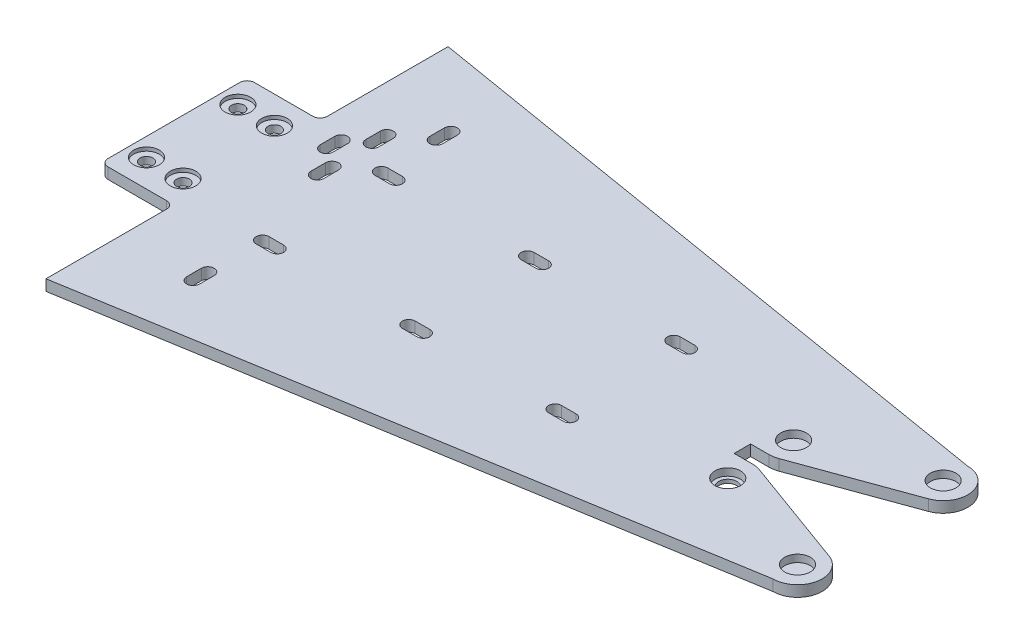
from build123d import *

# Parameters (mm, degrees)
SKETCH_1_W           = 35
SKETCH_1_H           = 55
EXTRUDE_1_DEPTH      = 1
EXTRUDE_2_DEPTH      = 3
SKETCH_3_R           = 5
CUT_EXTRUDE_1_DEPTH  = 169.569903897
SKETCH_4_R           = 4
CUT_EXTRUDE_2_DEPTH  = 2
SKETCH_5_R           = 2
CUT_EXTRUDE_3_DEPTH  = 2
EXTRUDE_START        = 7
EXTRUDE_3_DEPTH      = 7
CUT_EXTRUDE_START    = -1.5
SKETCH_9_W           = 10
SKETCH_9_H           = 26
CUT_EXTRUDE_4_DEPTH  = 168.318874833
SKETCH_10_R          = 1.5
CUT_EXTRUDE_5_DEPTH  = 194.595583627
EXTRUDE_START_2      = -3
EXTRUDE_4_DEPTH      = 3
SKETCH_12_R          = 9
SKETCH_12_R_2        = 5
EXTRUDE_5_DEPTH      = 2.5
SKETCH_13_R          = 7.5
CUT_EXTRUDE_6_DEPTH  = 4
SKETCH_14_W          = 10
SKETCH_14_H          = 26
CUT_EXTRUDE_7_DEPTH  = 2
EXTRUDE_START_3      = -1
EXTRUDE_6_DEPTH      = 2
CUT_EXTRUDE_8_DEPTH  = 170.92003224
SKETCH_17_W          = 35
SKETCH_17_H          = 55
CUT_EXTRUDE_9_DEPTH  = 1
SKETCH_19_R          = 9
EXTRUDE_8_DEPTH      = 2.5
SKETCH_20_W          = 13
SKETCH_20_H          = 1.5
EXTRUDE_9_DEPTH      = 5.5
SKETCH_21_R          = 3.5
CUT_EXTRUDE_10_DEPTH = 2
CUT_EXTRUDE_11_DEPTH = 10
SKETCH_23_R          = 1.75
CUT_EXTRUDE_12_DEPTH = 10
SKETCH_25_R          = 1.75
CUT_EXTRUDE_14_DEPTH = 170.71466453
SKETCH_29_W          = 168.729827701
SKETCH_29_H          = 37.82128197
CUT_EXTRUDE_16_DEPTH = 188.307580884
SKETCH_30_W          = 40
SKETCH_30_H          = 3
EXTRUDE_10_DEPTH     = 20
CUT_EXTRUDE_17_DEPTH = 10
SKETCH_32_R          = 3.5
CUT_EXTRUDE_18_DEPTH = 1
SKETCH_33_R          = 2.5
CUT_EXTRUDE_19_DEPTH = 1
CUT_EXTRUDE_21_DEPTH = 168.79563411
SKETCH_35_W          = 4.5
SKETCH_35_H          = 3
EXTRUDE_11_DEPTH     = 10
FILLET_1_R           = 2
FILLET_2_R           = 2


with BuildPart() as part:
    # 草图1 → 凸台-拉伸1 (new body)
    with BuildSketch(Plane(origin=(0, 0, 0), x_dir=(1, 0, 0), z_dir=(0, 1, 0))):
        Rectangle(SKETCH_1_W, SKETCH_1_H)
    extrude(amount=EXTRUDE_1_DEPTH)

    # 草图2 → 凸台-拉伸2 (add)
    with BuildSketch(Plane(origin=(0, 1, 0), x_dir=(1, 0, 0), z_dir=(0, 1, 0))):
        with BuildLine():
            Line((106.75, -2.25), (106.75, 2.25))
            Line((106.75, 2.25), (121.75, 2.25))
            ThreePointArc((121.75, 2.25), (122.922125199, 2.352547667), (124.058635967, 2.65707481))
            Line((124.058635967, 2.65707481), (154.058635967, 13.576181838))
            ThreePointArc((154.058635967, 13.576181838), (158.397452333, 21.091232227), (151.75, 26.669107028))
            Line((151.75, 26.669107028), (-31.447415548, 57.101298968))
            ThreePointArc((-31.447415548, 57.101298968), (-37.800418235, 56.264673928), (-42.609265279, 52.029632639))
            Line((-42.609265279, 52.029632639), (-60.161792173, 23.605896086))
            ThreePointArc((-60.161792173, 23.605896086), (-61.717833724, 20.073278016), (-62.25, 16.25))
            Line((-62.25, 16.25), (-62.25, -16.25))
            ThreePointArc((-62.25, -16.25), (-61.717833724, -20.073278016), (-60.161792173, -23.605896086))
            Line((-60.161792173, -23.605896086), (-42.609265279, -52.029632639))
            ThreePointArc((-42.609265279, -52.029632639), (-37.800418235, -56.264673928), (-31.447415548, -57.101298968))
            Line((-31.447415548, -57.101298968), (151.75, -26.669107028))
            ThreePointArc((151.75, -26.669107028), (158.397452333, -21.091232227), (154.058635967, -13.576181838))
            Line((154.058635967, -13.576181838), (124.058635967, -2.65707481))
            ThreePointArc((124.058635967, -2.65707481), (122.922125199, -2.352547667), (121.75, -2.25))
            Line((121.75, -2.25), (106.75, -2.25))
        make_face()
    extrude(amount=EXTRUDE_2_DEPTH)

    # 草图3 → 切除-拉伸1 (cut, through all)
    with BuildSketch(Plane(origin=(0, 4, 0), x_dir=(1, 0, 0), z_dir=(0, 1, 0))):
        with Locations(Location((-48.25, 16.25, 0), (0, 0, 270))):
            Circle(SKETCH_3_R)
        with Locations(Location((-48.25, -16.25, 0), (0, 0, 270))):
            Circle(SKETCH_3_R)
    extrude(amount=-CUT_EXTRUDE_1_DEPTH, mode=Mode.SUBTRACT)

    # 草图4 → 切除-拉伸2 (cut)
    with BuildSketch(Plane(origin=(0, 4, 0), x_dir=(1, 0, 0), z_dir=(0, 1, 0))):
        with Locations(Location((-33.25, 46.25, 0), (0, 0, 270))):
            Circle(SKETCH_4_R)
        with Locations(Location((-33.25, -46.25, 0), (0, 0, 270))):
            Circle(SKETCH_4_R)
    extrude(amount=-CUT_EXTRUDE_2_DEPTH, mode=Mode.SUBTRACT)

    # 草图5 → 切除-拉伸3 (cut)
    with BuildSketch(Plane(origin=(0, 4, 0), x_dir=(1, 0, 0), z_dir=(0, 1, 0))):
        with Locations(Location((121.75, 9, 0), (0, 0, 270))):
            Circle(SKETCH_5_R)
        with Locations(Location((121.75, -9, 0), (0, 0, 270))):
            Circle(SKETCH_5_R)
        with Locations(Location((151.75, 19.919107028, 0), (0, 0, 270))):
            Circle(SKETCH_5_R)
        with Locations(Location((151.75, -19.919107028, 0), (0, 0, 270))):
            Circle(SKETCH_5_R)
    extrude(amount=-CUT_EXTRUDE_3_DEPTH, mode=Mode.SUBTRACT)

    # 草图8 → 凸台-拉伸3 (add)
    with BuildSketch(Plane.XZ.offset(-1).offset(EXTRUDE_START)):
        with BuildLine():
            Line((-26.75, -26.25), (-39.75, -26.25))
            Line((-39.75, -26.25), (-39.75, -55.124119675))
            ThreePointArc((-39.75, -55.124119675), (-35.798281322, -56.950759894), (-31.447415548, -57.101298968))
            Line((-31.447415548, -57.101298968), (-26.75, -56.320978726))
            Line((-26.75, -56.320978726), (-26.75, -26.25))
        make_face()
    extrude_3 = extrude(amount=-EXTRUDE_3_DEPTH)

    # 镜向1: 凸台-拉伸3 across plane
    add(extrude_3.mirror(Plane.XY))

    # 草图9 → 切除-拉伸4 (cut, through all)
    with BuildSketch(Plane.XZ.offset(6).offset(CUT_EXTRUDE_START)):
        with Locations((-33.25, -40.75)):
            Rectangle(SKETCH_9_W, SKETCH_9_H)
    cut_extrude_4 = extrude(amount=-CUT_EXTRUDE_4_DEPTH, mode=Mode.SUBTRACT)

    # 镜向2: 切除-拉伸4 across plane
    add(cut_extrude_4.mirror(Plane.XY), mode=Mode.SUBTRACT)

    # 草图10 → 切除-拉伸5 (cut, through all)
    with BuildSketch(Plane.XY.offset(-53.75)):
        with Locations((-33.25, -1.5)):
            Circle(SKETCH_10_R)
    cut_extrude_5 = extrude(amount=-CUT_EXTRUDE_5_DEPTH, mode=Mode.SUBTRACT)

    # 镜向3: 切除-拉伸5 across plane
    add(cut_extrude_5.mirror(Plane.XY), mode=Mode.SUBTRACT)

    # 草图11 → 凸台-拉伸4 (add)
    with BuildSketch(Plane(origin=(0, 4, 0), x_dir=(1, 0, 0), z_dir=(0, 1, 0)).offset(EXTRUDE_START_2)):
        with BuildLine():
            Line((-62.25, 50.419925161), (-62.25, 16.25))
            ThreePointArc((-62.25, 16.25), (-61.717833724, 20.073278016), (-60.161792173, 23.605896086))
            Line((-60.161792173, 23.605896086), (-42.609265279, 52.029632639))
            ThreePointArc((-42.609265279, 52.029632639), (-37.800418235, 56.264673928), (-31.447415548, 57.101298968))
            Line((-31.447415548, 57.101298968), (-50.611286861, 60.284742405))
            ThreePointArc((-50.611286861, 60.284742405), (-58.715789535, 58.048395892), (-62.25, 50.419925161))
        make_face()
        with BuildLine():
            ThreePointArc((-60.161792173, -23.605896086), (-61.717833724, -20.073278016), (-62.25, -16.25))
            Line((-62.25, -16.25), (-62.25, -50.419925161))
            ThreePointArc((-62.25, -50.419925161), (-58.715789535, -58.048395892), (-50.611286861, -60.284742405))
            Line((-50.611286861, -60.284742405), (-31.447415548, -57.101298968))
            ThreePointArc((-31.447415548, -57.101298968), (-37.800418235, -56.264673928), (-42.609265279, -52.029632639))
            Line((-42.609265279, -52.029632639), (-60.161792173, -23.605896086))
        make_face()
    extrude(amount=EXTRUDE_4_DEPTH)

    # 草图12 → 凸台-拉伸5 (add)
    # profile 1 of 2: a face of its own
    with BuildSketch(Plane.XZ.offset(-1)):
        with Locations(Location((-48.25, 16.25, 0), (0, 0, 90))):
            Circle(SKETCH_12_R)
        with Locations(Location((-48.25, 16.25, 0), (0, 0, 90))):
            Circle(SKETCH_12_R_2, mode=Mode.SUBTRACT)
    # profile 2 of 2: a face of its own
    with BuildSketch(Plane.XZ.offset(-1)):
        with Locations(Location((-48.25, -16.25, 0), (0, 0, 90))):
            Circle(SKETCH_12_R)
        with Locations(Location((-48.25, -16.25, 0), (0, 0, 90))):
            Circle(SKETCH_12_R_2, mode=Mode.SUBTRACT)
    extrude(amount=EXTRUDE_5_DEPTH)

    # 草图13 → 切除-拉伸6 (cut)
    with BuildSketch(Plane(origin=(0, 4, 0), x_dir=(1, 0, 0), z_dir=(0, 1, 0))):
        with Locations(Location((-48.25, 16.25, 0), (0, 0, 270))):
            Circle(SKETCH_13_R)
        with Locations(Location((-48.25, -16.25, 0), (0, 0, 270))):
            Circle(SKETCH_13_R)
    extrude(amount=-CUT_EXTRUDE_6_DEPTH, mode=Mode.SUBTRACT)

    # 草图14 → 切除-拉伸7 (cut)
    with BuildSketch(Plane(origin=(0, 4, 0), x_dir=(1, 0, 0), z_dir=(0, 1, 0))):
        with Locations((-33.25, 40.75)):
            Rectangle(SKETCH_14_W, SKETCH_14_H)
        Polygon((-20.75, 55.324277157), (-45.75, 59.477200364), (-45.75, 27.75), (-38.25, 27.75), (-38.25, 53.75), (-28.25, 53.75), (-28.25, 27.75), (-20.75, 27.75), align=None)
    cut_extrude_7 = extrude(amount=-CUT_EXTRUDE_7_DEPTH, mode=Mode.SUBTRACT)

    # 草图15 → 凸台-拉伸6 (add)
    with BuildSketch(Plane(origin=(0, 2, 0), x_dir=(1, 0, 0), z_dir=(0, 1, 0)).offset(EXTRUDE_START_3)):
        Polygon((-18.75, 54.9920433), (-47.75, 59.80943422), (-47.75, 25.75), (-30.25, 25.75), (-18.75, 25.75), align=None)
    extrude_6 = extrude(amount=-EXTRUDE_6_DEPTH)

    # 草图16 → 切除-拉伸8 (cut, through all)
    with BuildSketch(Plane.XZ.offset(6)):
        with BuildLine():
            Line((-31.447415548, -57.101298968), (-26.75, -56.320978726))
            Line((-26.75, -56.320978726), (-26.75, -26.25))
            Line((-26.75, -26.25), (-39.75, -26.25))
            Line((-39.75, -26.25), (-39.75, -55.124119675))
            ThreePointArc((-39.75, -55.124119675), (-35.798281322, -56.950759894), (-31.447415548, -57.101298968))
        make_face()
        with BuildLine():
            Line((-39.75, -65.953183835), (-26.75, -64.748478677))
            Line((-26.75, -64.748478677), (-26.75, -56.320978726))
            Line((-26.75, -56.320978726), (-31.447415548, -57.101298968))
            ThreePointArc((-31.447415548, -57.101298968), (-35.798281322, -56.950759894), (-39.75, -55.124119675))
            Line((-39.75, -55.124119675), (-39.75, -65.953183835))
        make_face()
    cut_extrude_8 = extrude(amount=-CUT_EXTRUDE_8_DEPTH, mode=Mode.SUBTRACT)

    # 镜向4: 切除-拉伸4, 切除-拉伸7, 凸台-拉伸6, 切除-拉伸8 across plane
    add(cut_extrude_4.mirror(Plane.XY), mode=Mode.SUBTRACT)
    add(cut_extrude_7.mirror(Plane.XY), mode=Mode.SUBTRACT)
    add(extrude_6.mirror(Plane.XY))
    add(cut_extrude_8.mirror(Plane.XY), mode=Mode.SUBTRACT)

    # 草图17 → 切除-拉伸9 (cut)
    with BuildSketch(Plane.XZ):
        Rectangle(SKETCH_17_W, SKETCH_17_H)
    extrude(amount=-CUT_EXTRUDE_9_DEPTH, mode=Mode.SUBTRACT)

    # 草图19 → 凸台-拉伸8 (add)
    # profile 1 of 3: a face of its own
    with BuildSketch(Plane.XZ.offset(-1)):
        with BuildLine():
            Line((-50.611286861, -60.284742405), (-47.75, -59.80943422))
            Line((-47.75, -59.80943422), (-47.75, -25.75))
            Line((-47.75, -25.75), (-18.75, -25.75))
            Line((-18.75, -25.75), (-18.75, 25.75))
            Line((-18.75, 25.75), (-47.75, 25.75))
            Line((-47.75, 25.75), (-47.75, 59.80943422))
            Line((-47.75, 59.80943422), (-50.611286861, 60.284742405))
            ThreePointArc((-50.611286861, 60.284742405), (-58.715789535, 58.048395892), (-62.25, 50.419925161))
            Line((-62.25, 50.419925161), (-62.25, -50.419925161))
            ThreePointArc((-62.25, -50.419925161), (-58.715789535, -58.048395892), (-50.611286861, -60.284742405))
        make_face()
        with Locations((-48.25, -16.25)):
            Circle(SKETCH_19_R, mode=Mode.SUBTRACT)
        with Locations((-48.25, 16.25)):
            Circle(SKETCH_19_R, mode=Mode.SUBTRACT)
    # profile 2 of 3: a face of its own
    with BuildSketch(Plane.XZ.offset(-1)):
        Polygon((-26.75, 56.320978726), (-26.75, 26.25), (-39.75, 26.25), (-39.75, 58.480498794), (-47.75, 59.80943422), (-47.75, 25.75), (-18.75, 25.75), (-18.75, 54.9920433), align=None)
    # profile 3 of 3: a face of its own
    with BuildSketch(Plane.XZ.offset(-1)):
        Polygon((-26.75, -26.25), (-26.75, -56.320978726), (-18.75, -54.9920433), (-18.75, -25.75), (-47.75, -25.75), (-47.75, -59.80943422), (-39.75, -58.480498794), (-39.75, -26.25), align=None)
    extrude(amount=EXTRUDE_8_DEPTH)

    # 草图20 → 凸台-拉伸9 (add)
    with BuildSketch(Plane(origin=(0, 4, 0), x_dir=(1, 0, 0), z_dir=(0, 1, 0))):
        with Locations((-33.25, 27)):
            Rectangle(SKETCH_20_W, SKETCH_20_H)
        with Locations((-33.25, -27)):
            Rectangle(SKETCH_20_W, SKETCH_20_H)
    extrude(amount=-EXTRUDE_9_DEPTH)

    # 草图21 → 切除-拉伸10 (cut)
    with BuildSketch(Plane(origin=(0, 4, 0), x_dir=(1, 0, 0), z_dir=(0, 1, 0))):
        with Locations(Location((121.75, 9, 0), (0, 0, 270))):
            Circle(SKETCH_21_R)
        with Locations(Location((121.75, -9, 0), (0, 0, 270))):
            Circle(SKETCH_21_R)
        with Locations(Location((151.75, -19.919107028, 0), (0, 0, 270))):
            Circle(SKETCH_21_R)
        with Locations(Location((151.75, 19.919107028, 0), (0, 0, 270))):
            Circle(SKETCH_21_R)
    extrude(amount=-CUT_EXTRUDE_10_DEPTH, mode=Mode.SUBTRACT)

    # 草图22 → 切除-拉伸11 (cut)
    with BuildSketch(Plane(origin=(0, 4, 0), x_dir=(1, 0, 0), z_dir=(0, 1, 0))):
        with BuildLine():
            ThreePointArc((5.75, -14.5), (7.5, -16.25), (5.75, -18))
            Line((5.75, -18), (1.75, -18))
            ThreePointArc((1.75, -18), (0, -16.25), (1.75, -14.5))
            Line((1.75, -14.5), (5.75, -14.5))
        make_face()
        with BuildLine():
            ThreePointArc((85.75, -14.5), (87.5, -16.25), (85.75, -18))
            Line((85.75, -18), (81.75, -18))
            ThreePointArc((81.75, -18), (80, -16.25), (81.75, -14.5))
            Line((81.75, -14.5), (85.75, -14.5))
        make_face()
        with BuildLine():
            Line((3.5, 31.25), (3.5, 35.25))
            ThreePointArc((3.5, 35.25), (1.75, 37), (0, 35.25))
            Line((0, 35.25), (0, 31.25))
            ThreePointArc((0, 31.25), (1.75, 29.5), (3.5, 31.25))
        make_face()
        with BuildLine():
            Line((7.5, 16.25), (0, 16.25))
            ThreePointArc((0, 16.25), (0.512563133, 15.012563133), (1.75, 14.5))
            Line((1.75, 14.5), (5.75, 14.5))
            ThreePointArc((5.75, 14.5), (6.987436867, 15.012563133), (7.5, 16.25))
        make_face()
        with BuildLine():
            Line((81.75, 14.5), (85.75, 14.5))
            ThreePointArc((85.75, 14.5), (87.5, 16.25), (85.75, 18))
            Line((85.75, 18), (81.75, 18))
            ThreePointArc((81.75, 18), (80, 16.25), (81.75, 14.5))
        make_face()
        with BuildLine():
            ThreePointArc((1.75, 18), (0.512563133, 17.487436867), (0, 16.25))
            Line((0, 16.25), (7.5, 16.25))
            ThreePointArc((7.5, 16.25), (6.987436867, 17.487436867), (5.75, 18))
            Line((5.75, 18), (1.75, 18))
        make_face()
        with BuildLine():
            Line((3.5, -31.25), (3.5, -35.25))
            ThreePointArc((3.5, -35.25), (1.75, -37), (0, -35.25))
            Line((0, -35.25), (0, -31.25))
            ThreePointArc((0, -31.25), (1.75, -29.5), (3.5, -31.25))
        make_face()
        with BuildLine():
            Line((41.75, -18), (45.75, -18))
            ThreePointArc((45.75, -18), (47.5, -16.25), (45.75, -14.5))
            Line((45.75, -14.5), (41.75, -14.5))
            ThreePointArc((41.75, -14.5), (40, -16.25), (41.75, -18))
        make_face()
        with BuildLine():
            Line((41.75, 14.5), (45.75, 14.5))
            ThreePointArc((45.75, 14.5), (47.5, 16.25), (45.75, 18))
            Line((45.75, 18), (41.75, 18))
            ThreePointArc((41.75, 18), (40, 16.25), (41.75, 14.5))
        make_face()
    extrude(amount=-CUT_EXTRUDE_11_DEPTH, mode=Mode.SUBTRACT)

    # 草图23 → 切除-拉伸12 (cut)
    with BuildSketch(Plane(origin=(0, 4, 0), x_dir=(1, 0, 0), z_dir=(0, 1, 0))):
        with Locations(Location((-42.75, 42.75, 0), (0, 0, 270))):
            Circle(SKETCH_23_R)
        with Locations(Location((-42.75, 32.75, 0), (0, 0, 270))):
            Circle(SKETCH_23_R)
        with Locations(Location((-23.75, 32.75, 0), (0, 0, 270))):
            Circle(SKETCH_23_R)
        with Locations(Location((-23.75, 42.75, 0), (0, 0, 270))):
            Circle(SKETCH_23_R)
    cut_extrude_12 = extrude(amount=-CUT_EXTRUDE_12_DEPTH, mode=Mode.SUBTRACT)

    # 镜向5: 切除-拉伸12 across plane
    add(cut_extrude_12.mirror(Plane.XY), mode=Mode.SUBTRACT)

    # 草图25 → 切除-拉伸14 (cut, through all)
    with BuildSketch(Plane(origin=(0, 4, 0), x_dir=(1, 0, 0), z_dir=(0, 1, 0))):
        with Locations(Location((-52.25, -50.419925161, 0), (0, 0, 270))):
            Circle(SKETCH_25_R)
        with Locations(Location((-52.25, 50.419925161, 0), (0, 0, 270))):
            Circle(SKETCH_25_R)
    extrude(amount=-CUT_EXTRUDE_14_DEPTH, mode=Mode.SUBTRACT)

    # 草图29 → 切除-拉伸16 (cut, through all)
    with BuildSketch(Plane(origin=(-18.75, 0, 0), x_dir=(0, 0, -1), z_dir=(1, 0, 0))):
        with Locations((12.973579281, -2.962650989)):
            Rectangle(SKETCH_29_W, SKETCH_29_H)
    extrude(amount=-CUT_EXTRUDE_16_DEPTH, mode=Mode.SUBTRACT)

    # 草图30 → 凸台-拉伸10 (add)
    with BuildSketch(Plane.ZY.offset(18.75)):
        with Locations((0, 2.5)):
            Rectangle(SKETCH_30_W, SKETCH_30_H)
    extrude(amount=EXTRUDE_10_DEPTH)

    # 草图31 → 切除-拉伸17 (cut)
    with BuildSketch(Plane(origin=(0, 4, 0), x_dir=(1, 0, 0), z_dir=(0, 1, 0))):
        with BuildLine():
            ThreePointArc((-25.5, 12.5), (-24.987436867, 11.262563133), (-23.75, 10.75))
            Line((-23.75, 10.75), (-23.75, 12.5))
            Line((-23.75, 12.5), (-25.5, 12.5))
        make_face()
        with BuildLine():
            Line((-23.75, 12.5), (-23.75, 10.75))
            ThreePointArc((-23.75, 10.75), (-22.512563133, 11.262563133), (-22, 12.5))
            ThreePointArc((-22, 12.5), (-23.75, 14.25), (-25.5, 12.5))
            Line((-25.5, 12.5), (-23.75, 12.5))
        make_face()
        with BuildLine():
            ThreePointArc((-32, 12.5), (-34.987436867, 13.737436867), (-33.75, 10.75))
            Line((-33.75, 10.75), (-33.75, 12.5))
            Line((-33.75, 12.5), (-32, 12.5))
        make_face()
        with BuildLine():
            Line((-33.75, 12.5), (-33.75, 10.75))
            ThreePointArc((-33.75, 10.75), (-32.512563133, 11.262563133), (-32, 12.5))
            Line((-32, 12.5), (-33.75, 12.5))
        make_face()
        with BuildLine():
            ThreePointArc((-22, -12.5), (-22.512563133, -11.262563133), (-23.75, -10.75))
            Line((-23.75, -10.75), (-23.75, -12.5))
            Line((-23.75, -12.5), (-25.5, -12.5))
            ThreePointArc((-25.5, -12.5), (-23.75, -14.25), (-22, -12.5))
        make_face()
        with BuildLine():
            Line((-23.75, -12.5), (-23.75, -10.75))
            ThreePointArc((-23.75, -10.75), (-24.987436867, -11.262563133), (-25.5, -12.5))
            Line((-25.5, -12.5), (-23.75, -12.5))
        make_face()
        with BuildLine():
            ThreePointArc((-32, -12.5), (-32.512563133, -11.262563133), (-33.75, -10.75))
            Line((-33.75, -10.75), (-33.75, -12.5))
            Line((-33.75, -12.5), (-32, -12.5))
        make_face()
        with BuildLine():
            Line((-33.75, -12.5), (-33.75, -10.75))
            ThreePointArc((-33.75, -10.75), (-34.987436867, -13.737436867), (-32, -12.5))
            Line((-32, -12.5), (-33.75, -12.5))
        make_face()
    extrude(amount=-CUT_EXTRUDE_17_DEPTH, mode=Mode.SUBTRACT)

    # 草图32 → 切除-拉伸18 (cut)
    with BuildSketch(Plane(origin=(0, 4, 0), x_dir=(1, 0, 0), z_dir=(0, 1, 0))):
        with Locations(Location((-23.75, 12.5, 0), (0, 0, 270))):
            Circle(SKETCH_32_R)
        with Locations(Location((-33.75, 12.5, 0), (0, 0, 270))):
            Circle(SKETCH_32_R)
        with Locations(Location((-33.75, -12.5, 0), (0, 0, 270))):
            Circle(SKETCH_32_R)
        with Locations(Location((-23.75, -12.5, 0), (0, 0, 270))):
            Circle(SKETCH_32_R)
    extrude(amount=-CUT_EXTRUDE_18_DEPTH, mode=Mode.SUBTRACT)

    # 草图33 → 切除-拉伸19 (cut)
    with BuildSketch(Plane(origin=(0, 2, 0), x_dir=(1, 0, 0), z_dir=(0, 1, 0))):
        with Locations(Location((121.75, -9, 0), (0, 0, 270))):
            Circle(SKETCH_33_R)
    extrude(amount=-CUT_EXTRUDE_19_DEPTH, mode=Mode.SUBTRACT)

    # 草图34 → 切除-拉伸21 (cut, through all)
    with BuildSketch(Plane(origin=(0, 4, 0), x_dir=(1, 0, 0), z_dir=(0, 1, 0))):
        with BuildLine():
            Line((-13, 14.25), (-13, 18.25))
            ThreePointArc((-13, 18.25), (-11.25, 20), (-9.5, 18.25))
            Line((-9.5, 18.25), (-9.5, 14.25))
            ThreePointArc((-9.5, 14.25), (-11.25, 12.5), (-13, 14.25))
        make_face()
        with BuildLine():
            Line((-8, 21.75), (-8, 25.75))
            ThreePointArc((-8, 25.75), (-6.25, 27.5), (-4.5, 25.75))
            Line((-4.5, 25.75), (-4.5, 21.75))
            ThreePointArc((-4.5, 21.75), (-6.25, 20), (-8, 21.75))
        make_face()
        with BuildLine():
            Line((-8, 6.75), (-8, 10.75))
            ThreePointArc((-8, 10.75), (-6.25, 12.5), (-4.5, 10.75))
            Line((-4.5, 10.75), (-4.5, 6.75))
            ThreePointArc((-4.5, 6.75), (-6.25, 5), (-8, 6.75))
        make_face()
    extrude(amount=-CUT_EXTRUDE_21_DEPTH, mode=Mode.SUBTRACT)

    # 草图35 → 凸台-拉伸11 (add)
    with BuildSketch(Plane(origin=(106.75, 0, 0), x_dir=(0, 0, -1), z_dir=(1, 0, 0))):
        with Locations((0, 2.5)):
            Rectangle(SKETCH_35_W, SKETCH_35_H)
    extrude(amount=EXTRUDE_11_DEPTH)

    # 圆角1
    fillet_1_edges = [part.edges().sort_by_distance(p)[0] for p in [
        (-38.75, 2.5, 20),
        (-38.75, 2.5, -20),
    ]]
    fillet(fillet_1_edges, radius=FILLET_1_R)

    # 圆角2
    fillet_2_edges = [part.edges().sort_by_distance(p)[0] for p in [
        (-18.75, 2.5, 20),
        (-18.75, 2.5, -20),
    ]]
    fillet(fillet_2_edges, radius=FILLET_2_R)


solid = part.part
